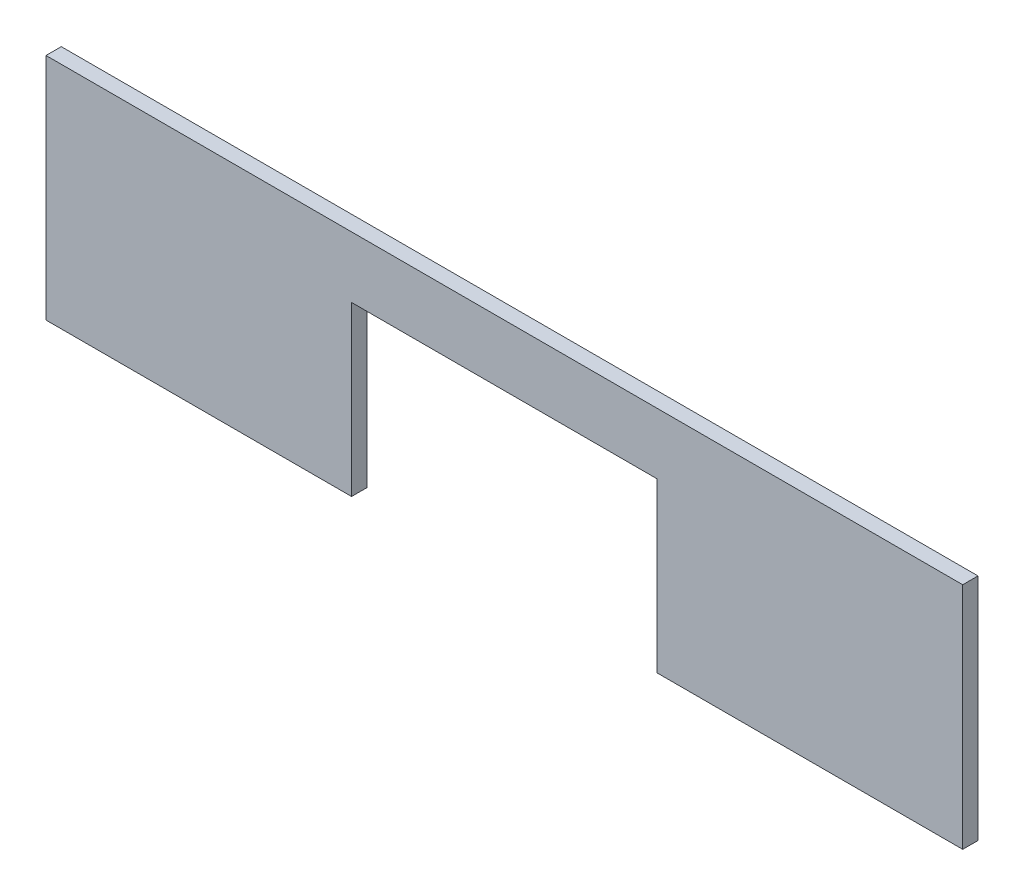
from build123d import *

# Parameters (mm, degrees)
BOSS_EXTRUDE1_DEPTH = 10


with BuildPart() as part:
    # Sketch1 → Boss-Extrude1 (new body)
    with BuildSketch(Plane.XY):
        Polygon((-300, 75), (-300, -75), (-100, -75), (-100, 35), (100, 35), (100, -75), (300, -75), (300, 75), align=None)
    extrude(amount=BOSS_EXTRUDE1_DEPTH)


solid = part.part
